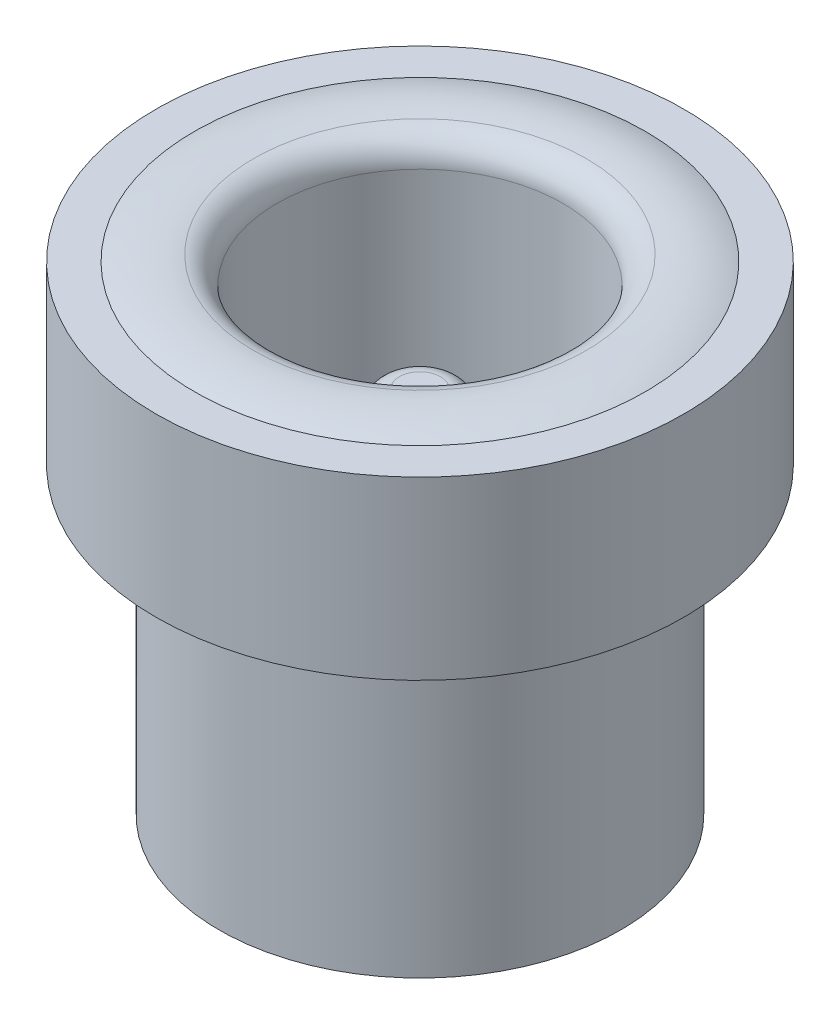
from build123d import *

# Parameters (mm, degrees)
SKETCH1_R           = 4.8
BOSS_EXTRUDE1_DEPTH = 3.2
SKETCH2_R           = 3.65
BOSS_EXTRUDE2_DEPTH = 5.5
SKETCH3_R           = 2.6
CUT_EXTRUDE1_DEPTH  = 8
FILLET1_R           = 0.5
SKETCH5_R           = 0.75
BOSS_EXTRUDE3_DEPTH = 6
FILLET2_R           = 0.375


with BuildPart() as part:
    # Sketch1 → Boss-Extrude1 (new body)
    with BuildSketch(Plane(origin=(0, 0, 0), x_dir=(1, 0, 0), z_dir=(0, 1, 0))):
        with Locations(Location((0, 0, 0), (0, 0, 270))):
            Circle(SKETCH1_R)
    extrude(amount=BOSS_EXTRUDE1_DEPTH)

    # Sketch2 → Boss-Extrude2 (add)
    with BuildSketch(Plane.XZ):
        with Locations(Location((0, 0, 0), (0, 0, 270))):
            Circle(SKETCH2_R)
    extrude(amount=BOSS_EXTRUDE2_DEPTH)

    # Sketch3 → Cut-Extrude1 (cut)
    with BuildSketch(Plane(origin=(0, 3.2, 0), x_dir=(1, 0, 0), z_dir=(0, 1, 0))):
        with Locations(Location((0, 0, 0), (0, 0, 270))):
            Circle(SKETCH3_R)
    extrude(amount=-CUT_EXTRUDE1_DEPTH, mode=Mode.SUBTRACT)

    # Sketch4 → Revolve1 (revolve)
    with BuildSketch(Plane.XY, mode=Mode.PRIVATE) as revolve1_sk:
        with BuildLine():
            Line((-4.1, 3.2), (-2.6, 3.2))
            ThreePointArc((-2.6, 3.2), (-3.35, 3.336000936), (-4.1, 3.2))
        make_face()
    revolve(revolve1_sk.sketch.rotate(Axis((0, 0, 0), (0, 1, 0)), 270), axis=Axis((0, 0, 0), (0, 1, 0)))

    # Fillet1
    fillet1_edges = [part.edges().sort_by_distance(p)[0] for p in [
        (2.6, 3.2, 0),
    ]]
    fillet(fillet1_edges, radius=FILLET1_R)

    # Sketch5 → Boss-Extrude3 (add)
    with BuildSketch(Plane(origin=(0, -4.8, 0), x_dir=(1, 0, 0), z_dir=(0, 1, 0))):
        with Locations(Location((0, 0, 0), (0, 0, 270))):
            Circle(SKETCH5_R)
    extrude(amount=BOSS_EXTRUDE3_DEPTH)

    # Fillet2
    fillet2_edges = [part.edges().sort_by_distance(p)[0] for p in [
        (0, 1.2, -0.75),
    ]]
    fillet(fillet2_edges, radius=FILLET2_R)


solid = part.part
